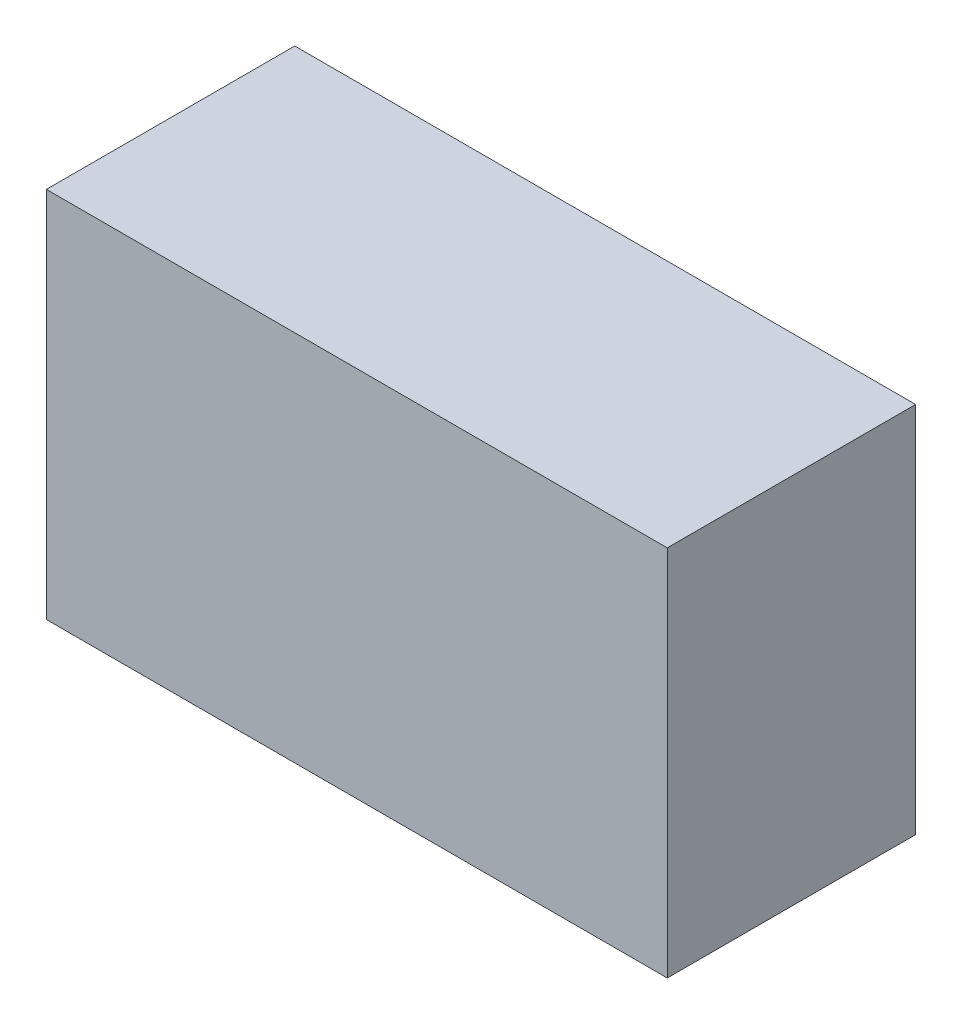
from build123d import *

# Parameters (mm, degrees)
SKETCH_1_W      = 25
SKETCH_1_H      = 15
EXTRUDE_1_DEPTH = 10
SCALE_1_SCALE   = 0.7


with BuildPart() as part:
    # 草图1 → 凸台-拉伸1 (new body)
    with BuildSketch(Plane.XY):
        with Locations((8.3125, 3.65625)):
            Rectangle(SKETCH_1_W, SKETCH_1_H)
    extrude(amount=EXTRUDE_1_DEPTH)


with BuildPart() as part_1:
    # 缩放比例1: scaled about (8.3125, 3.65625, 5)
    add(part.part.scale(SCALE_1_SCALE).moved(Location((2.49375, 1.096875, 1.5))))


solid = part_1.part
